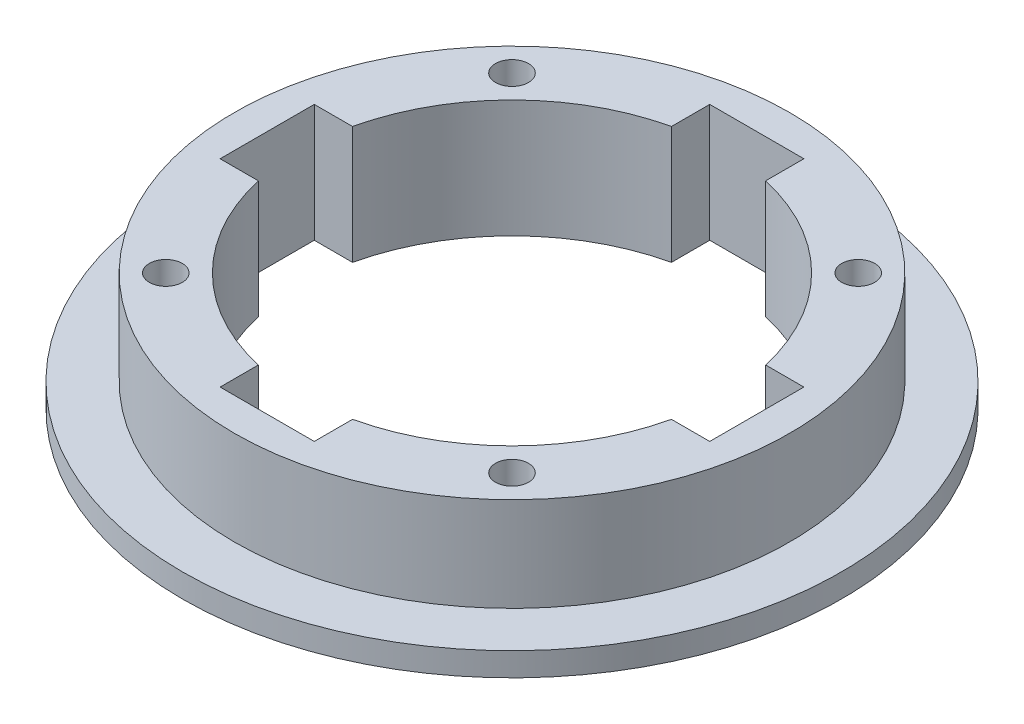
from build123d import *

# Parameters (mm, degrees)
SKETCH1_R           = 35
SKETCH1_R_2         = 22.5
BOSS_EXTRUDE1_DEPTH = 2.5
SKETCH2_R           = 29.5
SKETCH2_R_2         = 22.5
BOSS_EXTRUDE2_DEPTH = 10
CUT_EXTRUDE1_DEPTH  = 52.051444642
SKETCH4_R           = 1.75
CUT_EXTRUDE2_DEPTH  = 52.051444642


with BuildPart() as part:
    # Sketch1 → Boss-Extrude1 (new body)
    with BuildSketch(Plane(origin=(0, 0, 0), x_dir=(1, 0, 0), z_dir=(0, 1, 0))):
        with Locations(Location((0, 0, 0), (0, 0, 270))):
            Circle(SKETCH1_R)
        with Locations(Location((0, 0, 0), (0, 0, 270))):
            Circle(SKETCH1_R_2, mode=Mode.SUBTRACT)
    extrude(amount=BOSS_EXTRUDE1_DEPTH)

    # Sketch2 → Boss-Extrude2 (add)
    with BuildSketch(Plane(origin=(0, 2.5, 0), x_dir=(1, 0, 0), z_dir=(0, 1, 0))):
        with Locations(Location((0, 0, 0), (0, 0, 270))):
            Circle(SKETCH2_R)
        with Locations(Location((0, 0, 0), (0, 0, 270))):
            Circle(SKETCH2_R_2, mode=Mode.SUBTRACT)
    extrude(amount=BOSS_EXTRUDE2_DEPTH)

    # Sketch3 → Cut-Extrude1 (cut, through all)
    with BuildSketch(Plane(origin=(0, 12.5, 0), x_dir=(1, 0, 0), z_dir=(0, 1, 0))):
        with BuildLine():
            Line((-5, 21.937410968), (-5, 26))
            Line((-5, 26), (5, 26))
            Line((5, 26), (5, 21.937410968))
            ThreePointArc((5, 21.937410968), (15.909902577, 15.909902577), (21.937410968, 5))
            Line((21.937410968, 5), (26, 5))
            Line((26, 5), (26, -5))
            Line((26, -5), (21.937410968, -5))
            ThreePointArc((21.937410968, -5), (15.909902577, -15.909902577), (5, -21.937410968))
            Line((5, -21.937410968), (5, -26))
            Line((5, -26), (-5, -26))
            Line((-5, -26), (-5, -21.937410968))
            ThreePointArc((-5, -21.937410968), (-15.909902577, -15.909902577), (-21.937410968, -5))
            Line((-21.937410968, -5), (-26, -5))
            Line((-26, -5), (-26, 5))
            Line((-26, 5), (-21.937410968, 5))
            ThreePointArc((-21.937410968, 5), (-15.909902577, 15.909902577), (-5, 21.937410968))
        make_face()
    extrude(amount=-CUT_EXTRUDE1_DEPTH, mode=Mode.SUBTRACT)

    # Sketch4 → Cut-Extrude2 (cut, through all)
    with BuildSketch(Plane(origin=(0, 12.5, 0), x_dir=(1, 0, 0), z_dir=(0, 1, 0))):
        with Locations(Location((-18.384776311, -18.384776311, 0), (0, 0, 270))):
            Circle(SKETCH4_R)
        with Locations(Location((-18.384776311, 18.384776311, 0), (0, 0, 270))):
            Circle(SKETCH4_R)
        with Locations(Location((18.384776311, 18.384776311, 0), (0, 0, 270))):
            Circle(SKETCH4_R)
        with Locations(Location((18.384776311, -18.384776311, 0), (0, 0, 270))):
            Circle(SKETCH4_R)
    extrude(amount=-CUT_EXTRUDE2_DEPTH, mode=Mode.SUBTRACT)


solid = part.part
